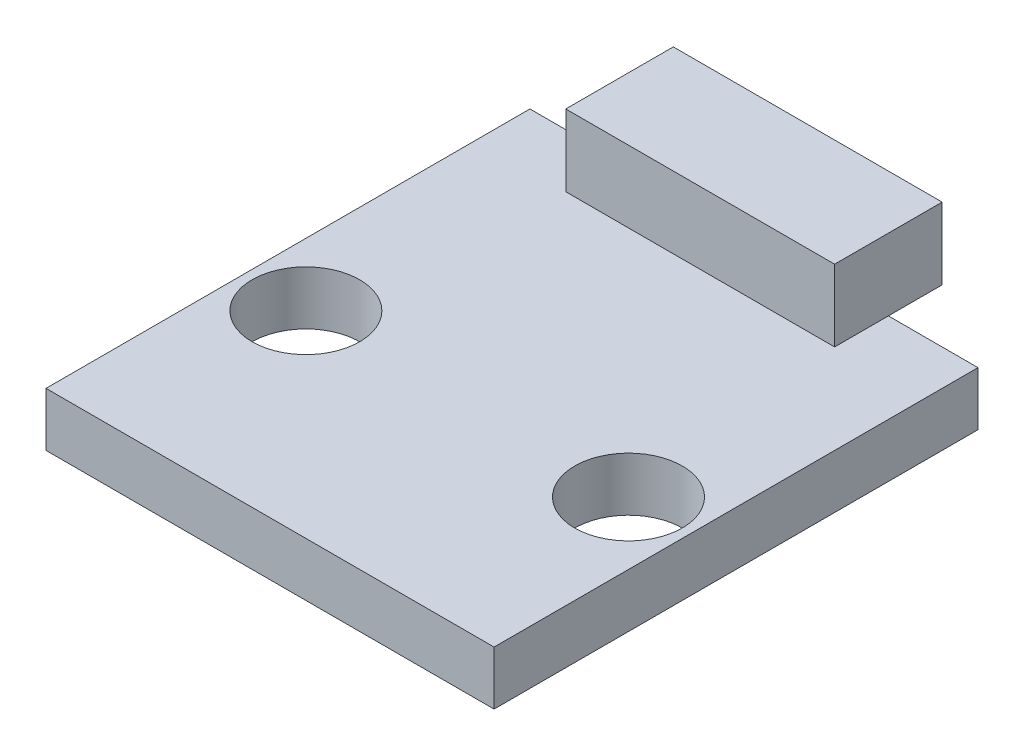
from build123d import *

# Parameters (mm, degrees)
SKETCH1_W           = 12.5
SKETCH1_H           = 13.5
BOSS_EXTRUDE1_DEPTH = 1.5
SKETCH2_W           = 7.5
SKETCH2_H           = 3
BOSS_EXTRUDE2_DEPTH = 2
SKETCH3_R           = 1.5
CUT_EXTRUDE4_DEPTH  = 11.541584321


with BuildPart() as part:
    # Sketch1 → Boss-Extrude1 (new body)
    with BuildSketch(Plane(origin=(0, 0, 0), x_dir=(1, 0, 0), z_dir=(0, 1, 0))):
        Rectangle(SKETCH1_W, SKETCH1_H)
    extrude(amount=BOSS_EXTRUDE1_DEPTH)

    # Sketch2 → Boss-Extrude2 (add)
    with BuildSketch(Plane(origin=(0, 1.5, 0), x_dir=(1, 0, 0), z_dir=(0, 1, 0))):
        with Locations((0, 6.75)):
            Rectangle(SKETCH2_W, SKETCH2_H)
    extrude(amount=BOSS_EXTRUDE2_DEPTH)

    # Sketch3 → Cut-Extrude4 (cut, through all)
    with BuildSketch(Plane(origin=(0, 1.5, 0), x_dir=(1, 0, 0), z_dir=(0, 1, 0))):
        with Locations(Location((-4.5, -1.25, 0), (0, 0, 270))):
            Circle(SKETCH3_R)
        with Locations(Location((4.5, -1.25, 0), (0, 0, 270))):
            Circle(SKETCH3_R)
    extrude(amount=-CUT_EXTRUDE4_DEPTH, mode=Mode.SUBTRACT)


solid = part.part
